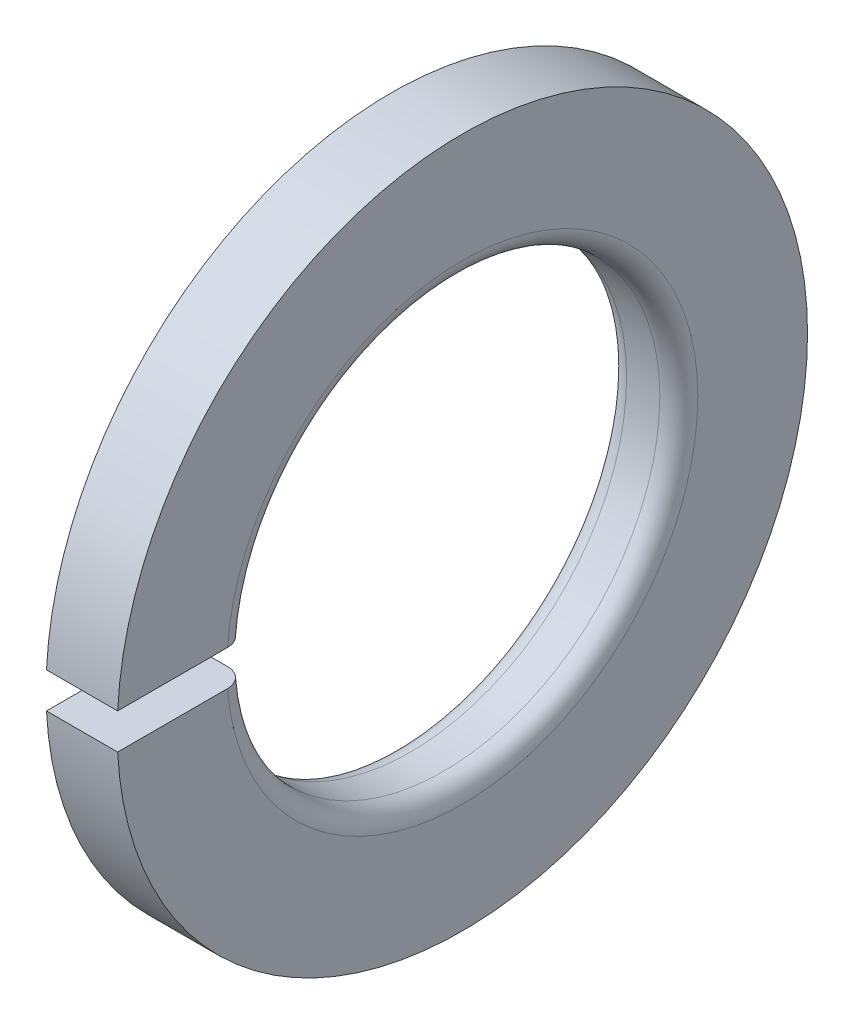
from build123d import *

# Parameters (mm, degrees)
SKETCH2_W = 3
SKETCH2_H = 29.682
GAP_DEPTH = 42.588700388


with BuildPart() as part:
    # Sketch1 → Base-Revolve (revolve)
    with BuildSketch(Plane.XY):
        with BuildLine():
            Line((0, 19.85), (0, 29.1))
            Line((0, 29.1), (-6, 29.1))
            Line((-6, 29.1), (-6, 19.85))
            ThreePointArc((-6, 19.85), (-5.53137085, 18.71862915), (-4.4, 18.25))
            Line((-4.4, 18.25), (-1.6, 18.25))
            ThreePointArc((-1.6, 18.25), (-0.46862915, 18.71862915), (0, 19.85))
        make_face()
    revolve(axis=Axis((-34.925, 0, 0), (1, 0, 0)))

    # Sketch2 → Gap (cut, through all)
    with BuildSketch(Plane(origin=(0, 0, 0), x_dir=(0, -1, 0), z_dir=(-1, 0, 0))):
        with Locations((0, 14.841)):
            Rectangle(SKETCH2_W, SKETCH2_H)
    extrude(amount=GAP_DEPTH, mode=Mode.SUBTRACT)


solid = part.part
